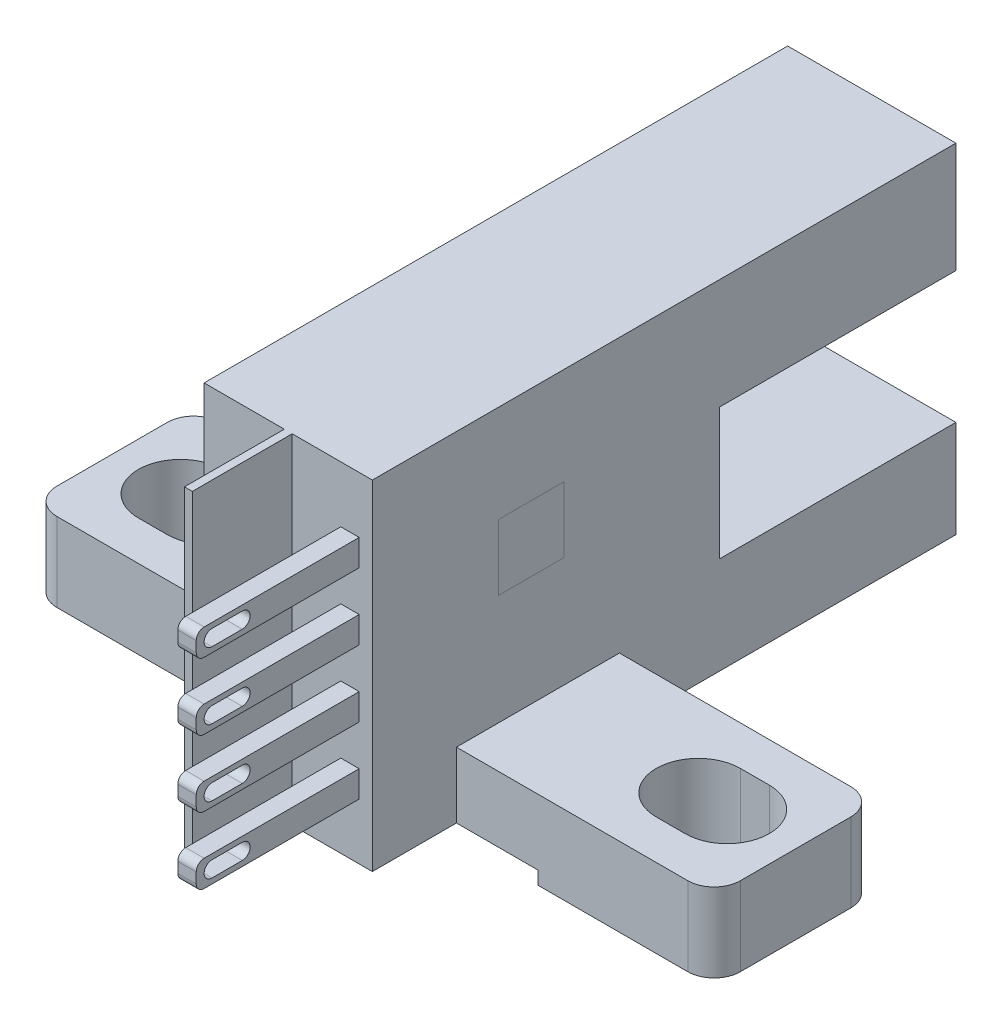
from build123d import *

# Parameters (mm, degrees)
SKETCH2_W               = 26
SKETCH2_H               = 6.2
BOSS_EXTRUDE1_DEPTH     = 3
SKETCH3_W               = 6.4
SKETCH3_H               = 22.2
BOSS_EXTRUDE2_DEPTH     = 13.4
SKETCH4_W               = 9
SKETCH4_H               = 5
CUT_EXTRUDE1_DEPTH      = 27.359248851
FILLET1_R               = 1
CUT_EXTRUDE2_DEPTH      = 25.522846491
CUT_EXTRUDE2_DEPTH_BACK = 25.522846491
SKETCH6_W               = 12.6
SKETCH6_H               = 0.5
SKETCH8_W               = 0.3
SKETCH8_H               = 3.8
BOSS_EXTRUDE4_DEPTH     = 12.9
BOSS_EXTRUDE5_START     = -0.5
BOSS_EXTRUDE5_DEPTH     = 0.7
CUT_EXTRUDE3_DEPTH      = 0.2


with BuildPart() as part:
    # Sketch2 → Boss-Extrude1 (new body)
    with BuildSketch(Plane(origin=(0, 0, 0), x_dir=(1, 0, 0), z_dir=(0, 1, 0))):
        Rectangle(SKETCH2_W, SKETCH2_H)
        with BuildLine():
            Line((-10.4, 1.6), (-9.3, 1.6))
            ThreePointArc((-9.3, 1.6), (-7.7, 0), (-9.3, -1.6))
            Line((-9.3, -1.6), (-10.4, -1.6))
            ThreePointArc((-10.4, -1.6), (-12, 0), (-10.4, 1.6))
        make_face(mode=Mode.SUBTRACT)
        with BuildLine():
            Line((10.4, 1.6), (9.3, 1.6))
            ThreePointArc((9.3, 1.6), (7.7, 0), (9.3, -1.6))
            Line((9.3, -1.6), (10.4, -1.6))
            ThreePointArc((10.4, -1.6), (12, 0), (10.4, 1.6))
        make_face(mode=Mode.SUBTRACT)
    extrude(amount=BOSS_EXTRUDE1_DEPTH)

    # Sketch3 → Boss-Extrude2 (add)
    with BuildSketch(Plane(origin=(0, 0, 0), x_dir=(1, 0, 0), z_dir=(0, 1, 0))):
        with Locations((0, 4.8)):
            Rectangle(SKETCH3_W, SKETCH3_H)
    extrude(amount=BOSS_EXTRUDE2_DEPTH)

    # Sketch4 → Cut-Extrude1 (cut, through all)
    with BuildSketch(Plane(origin=(3.2, 0, 0), x_dir=(0, 0, -1), z_dir=(1, 0, 0))):
        with Locations((11.4, 6.7)):
            Rectangle(SKETCH4_W, SKETCH4_H)
    extrude(amount=-CUT_EXTRUDE1_DEPTH, mode=Mode.SUBTRACT)

    # Fillet1
    fillet1_edges = [part.edges().sort_by_distance(p)[0] for p in [
        (-13, 1.5, -3.1),
        (13, 1.5, -3.1),
        (13, 1.5, 3.1),
        (-13, 1.5, 3.1),
    ]]
    fillet(fillet1_edges, radius=FILLET1_R)

    # Sketch6 → Cut-Extrude2 (cut, two sides: drawn at the far end of the back side and taken through both)
    with BuildSketch(Plane.XY.offset(-CUT_EXTRUDE2_DEPTH_BACK)):
        with Locations((0, 0.25)):
            Rectangle(SKETCH6_W, SKETCH6_H)
    extrude(amount=CUT_EXTRUDE2_DEPTH + CUT_EXTRUDE2_DEPTH_BACK, mode=Mode.SUBTRACT)

    # Sketch8 → Boss-Extrude4 (add)
    with BuildSketch(Plane(origin=(0, 13.4, 0), x_dir=(1, 0, 0), z_dir=(0, 1, 0))):
        with Locations((0, -8.2)):
            Rectangle(SKETCH8_W, SKETCH8_H)
    extrude(amount=-BOSS_EXTRUDE4_DEPTH)

    # Sketch9 → Boss-Extrude5 (add)
    # profile 1 of 4: a face of its own
    with BuildSketch(Plane(origin=(3.2, 0, 0), x_dir=(0, 0, -1), z_dir=(1, 0, 0)).offset(BOSS_EXTRUDE5_START)):
        with BuildLine():
            Line((-6.3, 7.72), (-12.2, 7.72))
            ThreePointArc((-12.2, 7.72), (-12.412132034, 7.807867966), (-12.5, 8.02))
            Line((-12.5, 8.02), (-12.5, 8.42))
            ThreePointArc((-12.5, 8.42), (-12.412132034, 8.632132034), (-12.2, 8.72))
            Line((-12.2, 8.72), (-6.3, 8.72))
            Line((-6.3, 8.72), (-6.3, 7.72))
        make_face()
        with BuildLine():
            Line((-11.9, 8.52), (-10.749572658, 8.52))
            ThreePointArc((-10.749572658, 8.52), (-10.449572658, 8.22), (-10.749572658, 7.92))
            Line((-10.749572658, 7.92), (-11.9, 7.92))
            ThreePointArc((-11.9, 7.92), (-12.2, 8.22), (-11.9, 8.52))
        make_face(mode=Mode.SUBTRACT)
    # profile 2 of 4: a face of its own
    with BuildSketch(Plane(origin=(3.2, 0, 0), x_dir=(0, 0, -1), z_dir=(1, 0, 0)).offset(BOSS_EXTRUDE5_START)):
        with BuildLine():
            Line((-6.3, 10.26), (-12.2, 10.26))
            ThreePointArc((-12.2, 10.26), (-12.412132034, 10.347867966), (-12.5, 10.56))
            Line((-12.5, 10.56), (-12.5, 10.96))
            ThreePointArc((-12.5, 10.96), (-12.412132034, 11.172132034), (-12.2, 11.26))
            Line((-12.2, 11.26), (-6.3, 11.26))
            Line((-6.3, 11.26), (-6.3, 10.26))
        make_face()
        with BuildLine():
            Line((-11.9, 11.06), (-10.749572658, 11.06))
            ThreePointArc((-10.749572658, 11.06), (-10.449572658, 10.76), (-10.749572658, 10.46))
            Line((-10.749572658, 10.46), (-11.9, 10.46))
            ThreePointArc((-11.9, 10.46), (-12.2, 10.76), (-11.9, 11.06))
        make_face(mode=Mode.SUBTRACT)
    # profile 3 of 4: a face of its own
    with BuildSketch(Plane(origin=(3.2, 0, 0), x_dir=(0, 0, -1), z_dir=(1, 0, 0)).offset(BOSS_EXTRUDE5_START)):
        with BuildLine():
            Line((-6.3, 5.18), (-12.2, 5.18))
            ThreePointArc((-12.2, 5.18), (-12.412132034, 5.267867966), (-12.5, 5.48))
            Line((-12.5, 5.48), (-12.5, 5.88))
            ThreePointArc((-12.5, 5.88), (-12.412132034, 6.092132034), (-12.2, 6.18))
            Line((-12.2, 6.18), (-6.3, 6.18))
            Line((-6.3, 6.18), (-6.3, 5.18))
        make_face()
        with BuildLine():
            Line((-11.9, 5.98), (-10.749572658, 5.98))
            ThreePointArc((-10.749572658, 5.98), (-10.449572658, 5.68), (-10.749572658, 5.38))
            Line((-10.749572658, 5.38), (-11.9, 5.38))
            ThreePointArc((-11.9, 5.38), (-12.2, 5.68), (-11.9, 5.98))
        make_face(mode=Mode.SUBTRACT)
    # profile 4 of 4: a face of its own
    with BuildSketch(Plane(origin=(3.2, 0, 0), x_dir=(0, 0, -1), z_dir=(1, 0, 0)).offset(BOSS_EXTRUDE5_START)):
        with BuildLine():
            Line((-6.3, 2.64), (-12.2, 2.64))
            ThreePointArc((-12.2, 2.64), (-12.412132034, 2.727867966), (-12.5, 2.94))
            Line((-12.5, 2.94), (-12.5, 3.34))
            ThreePointArc((-12.5, 3.34), (-12.412132034, 3.552132034), (-12.2, 3.64))
            Line((-12.2, 3.64), (-6.3, 3.64))
            Line((-6.3, 3.64), (-6.3, 2.64))
        make_face()
        with BuildLine():
            Line((-11.9, 3.44), (-10.749572658, 3.44))
            ThreePointArc((-10.749572658, 3.44), (-10.449572658, 3.14), (-10.749572658, 2.84))
            Line((-10.749572658, 2.84), (-11.9, 2.84))
            ThreePointArc((-11.9, 2.84), (-12.2, 3.14), (-11.9, 3.44))
        make_face(mode=Mode.SUBTRACT)
    extrude(amount=-BOSS_EXTRUDE5_DEPTH)

    # Sketch10 → Cut-Extrude3 (cut)
    with BuildSketch(Plane(origin=(0, 0, -15.9), x_dir=(-1, 0, 0), z_dir=(0, 0, -1))):
        Polygon((0, 10.297511632), (-1.041523937, 12.086883848), (1.041523937, 12.086883848), align=None)
        Polygon((1.041523937, 3.034586906), (-1.041523937, 3.034586906), (0, 1.447107426), align=None)
    extrude(amount=-CUT_EXTRUDE3_DEPTH, mode=Mode.SUBTRACT)


solid = part.part
